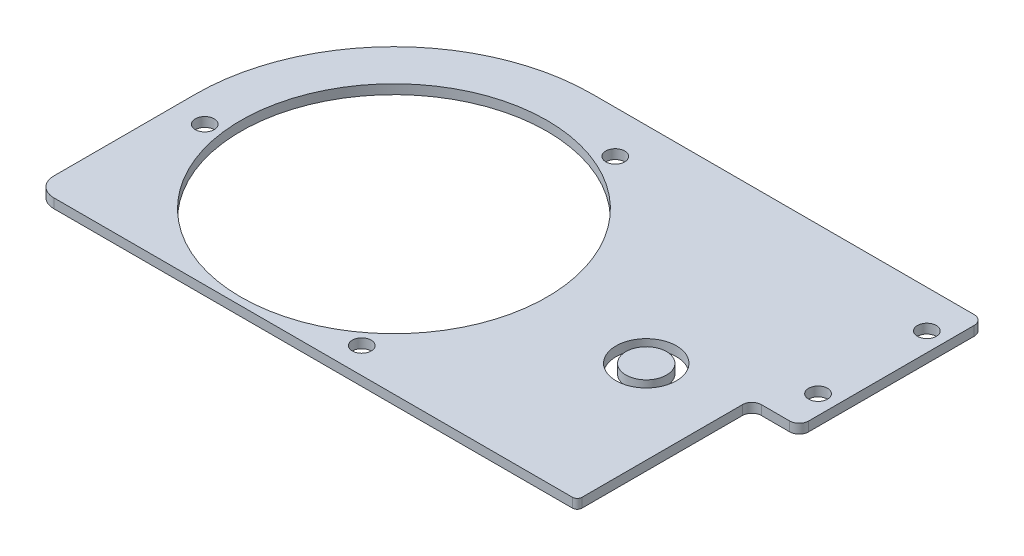
from build123d import *

# Parameters (mm, degrees)
SKETCH1_R           = 102.87
SKETCH1_R_2         = 6.35
BOSS_EXTRUDE1_DEPTH = 6.35
SKETCH6_R           = 20.32
SKETCH6_R_2         = 13.63940017
CUT_EXTRUDE1_DEPTH  = 28.448


with BuildPart() as part:
    # Sketch1 → Boss-Extrude1 (new body)
    with BuildSketch(Plane(origin=(0, 0, 0), x_dir=(1, 0, 0), z_dir=(0, 1, 0))):
        with BuildLine():
            Line((256.521079071, 133.368920929), (0, 133.368920929))
            ThreePointArc((0, 133.368920929), (-94.306068389, 94.306068389), (-133.368920929, 0))
            Line((-133.368920929, 0), (-133.368920929, -95.231079071))
            ThreePointArc((-133.368920929, -95.231079071), (-129.64917705, -104.211335192), (-120.668920929, -107.931079071))
            Line((-120.668920929, -107.931079071), (227.955539535, -107.931079071))
            ThreePointArc((227.955539535, -107.931079071), (230.193914007, -107.003914007), (231.121079071, -104.765539535))
            Line((231.121079071, -104.765539535), (231.121079071, 3.100777109))
            ThreePointArc((231.121079071, 3.100777109), (232.98095101, 7.59090517), (237.471079071, 9.450777109))
            Line((237.471079071, 9.450777109), (256.521079071, 9.450777109))
            ThreePointArc((256.521079071, 9.450777109), (261.011207131, 11.310649048), (262.871079071, 15.800777109))
            Line((262.871079071, 15.800777109), (262.871079071, 127.018920929))
            ThreePointArc((262.871079071, 127.018920929), (261.011207131, 131.50904899), (256.521079071, 133.368920929))
        make_face()
        with Locations(Location((0, 0, 0), (0, 0, 270))):
            Circle(SKETCH1_R, mode=Mode.SUBTRACT)
        with Locations(Location((-112.738641363, -14.374963544, 0), (0, 0, 270))):
            Circle(SKETCH1_R_2, mode=Mode.SUBTRACT)
        with Locations(Location((43.920237074, 104.822009181, 0), (0, 0, 270))):
            Circle(SKETCH1_R_2, mode=Mode.SUBTRACT)
        with Locations(Location((68.818404289, -90.447045637, 0), (0, 0, 270))):
            Circle(SKETCH1_R_2, mode=Mode.SUBTRACT)
        with Locations(Location((250.171079071, 107.968920929, 0), (0, 0, 270))):
            Circle(SKETCH1_R_2, mode=Mode.SUBTRACT)
        with Locations(Location((250.171079071, 34.850777109, 0), (0, 0, 270))):
            Circle(SKETCH1_R_2, mode=Mode.SUBTRACT)
    extrude(amount=BOSS_EXTRUDE1_DEPTH)

    # Sketch6 → Cut-Extrude1 (cut)
    with BuildSketch(Plane(origin=(0, 0, 0), x_dir=(1, 0, 0), z_dir=(0, 1, 0))):
        with Locations(Location((174.738689567, -5.189547123, 0), (0, 0, 90))):
            Circle(SKETCH6_R)
        with Locations(Location((174.738689567, -5.189547123, 0), (0, 0, 90))):
            Circle(SKETCH6_R_2, mode=Mode.SUBTRACT)
    extrude(amount=CUT_EXTRUDE1_DEPTH, mode=Mode.SUBTRACT)


with BuildPart() as cut_extrude1_piece_1:
    # of the separate pieces the step leaves, piece 1, a body of its own (cut_extrude1_pieces)
    add(part.part.solids().sort_by_distance((256.521079071, 0, -9.450777109))[0])


with BuildPart() as cut_extrude1_piece_2:
    # of the separate pieces the step leaves, piece 2, a body of its own (cut_extrude1_pieces)
    add(part.part.solids().sort_by_distance((174.738689567, 0, -8.449853047))[0])


solid = Compound([cut_extrude1_piece_1.part, cut_extrude1_piece_2.part])
